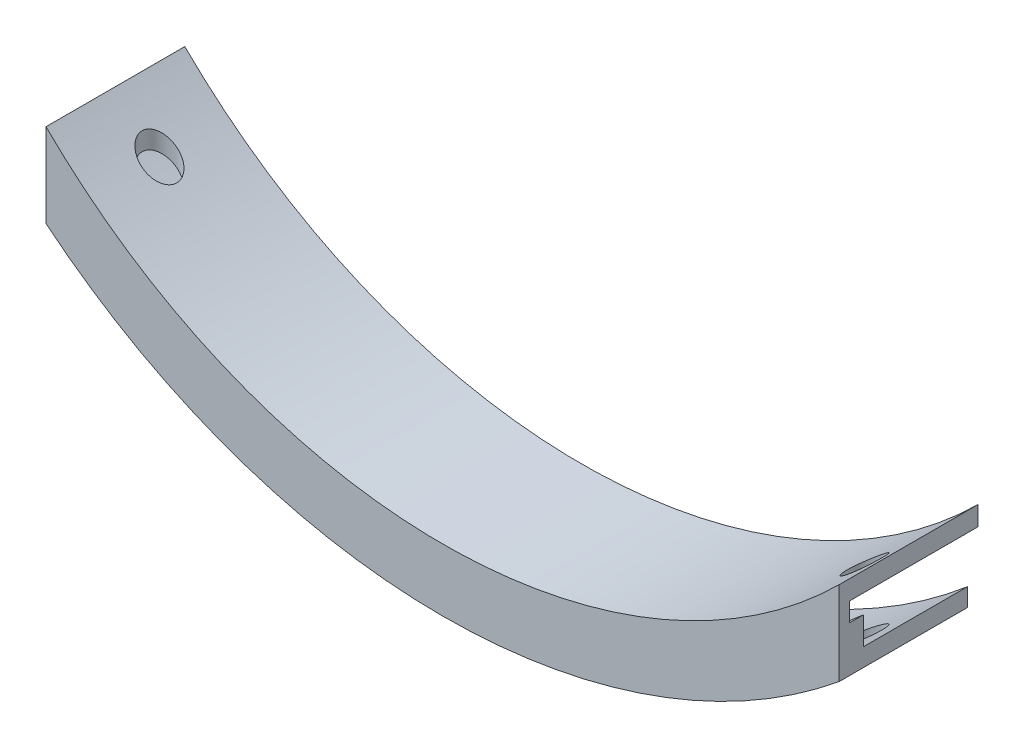
from build123d import *

# Parameters (mm, degrees)
BOSS_EXTRUDE1_DEPTH     = 40
SKETCH2_W               = 26
SKETCH2_H               = 6
CUT_EXTRUDE1_DEPTH      = 243.400412541
CUT_EXTRUDE1_DEPTH_BACK = 243.400412541
SKETCH4_R               = 2.5
SKETCH7_R               = 5
CUT_EXTRUDE3_DEPTH      = 62


with BuildPart() as part:
    # Sketch1 → Boss-Extrude1 (new body)
    with BuildSketch(Plane.XY):
        with BuildLine():
            Line((0, 0), (228.6, 0))
            Line((228.6, 0), (228.6, 70))
            ThreePointArc((228.6, 70), (114.3, 23.006536612), (0, 70))
            Line((0, 70), (0, 0))
        make_face()
    extrude(amount=BOSS_EXTRUDE1_DEPTH)

    # Sketch2 → Cut-Revolve1 (revolve, cut)
    with BuildSketch(Plane(origin=(114.3, 0, 0), x_dir=(0, 0, -1), z_dir=(1, 0, 0))):
        with Locations((-20, 12.006536612)):
            Rectangle(SKETCH2_W, SKETCH2_H)
    revolve(axis=Axis((114.3, 185.506536612, 40), (0, 0, 1)), mode=Mode.SUBTRACT)

    # Sketch4 → Cut-Extrude1 (cut, two sides: drawn at the far end of the back side and taken through both)
    with BuildSketch(Plane.XZ.offset(-CUT_EXTRUDE1_DEPTH_BACK)):
        with Locations(Location((12.7, 20, 0), (0, 0, 270))):
            Circle(SKETCH4_R)
        with Locations(Location((215.9, 20, 0), (0, 0, 270))):
            Circle(SKETCH4_R)
    extrude(amount=CUT_EXTRUDE1_DEPTH + CUT_EXTRUDE1_DEPTH_BACK, mode=Mode.SUBTRACT)

    # Sketch7 → Cut-Extrude3 (cut)
    with BuildSketch(Plane(origin=(0, 70, 0), x_dir=(-1, 0, 0), z_dir=(0, -1, 0))):
        with Locations(Location((-215.9, -20, 0), (0, 0, 270))):
            Circle(SKETCH7_R)
        with Locations(Location((-12.7, -20, 0), (0, 0, 270))):
            Circle(SKETCH7_R)
    extrude(amount=CUT_EXTRUDE3_DEPTH, mode=Mode.SUBTRACT)

    # Sketch8 → Cut-Revolve4 (revolve, cut)
    with BuildSketch(Plane(origin=(114.3, 0, 0), x_dir=(0, 0, -1), z_dir=(1, 0, 0))):
        Polygon((-7, 15.006536612), (-37, 15.006536612), (-37, 19.006536612), (0, 19.006536612), (0, -48.777467523), (-40, -48.777467523), (-40, 5.006536612), (-3, 5.006536612), (-3, 9.006536612), (-7, 9.006536612), align=None)
    revolve(axis=Axis((114.3, 185.506536612, 40), (0, 0, 1)), mode=Mode.SUBTRACT)


solid = part.part
